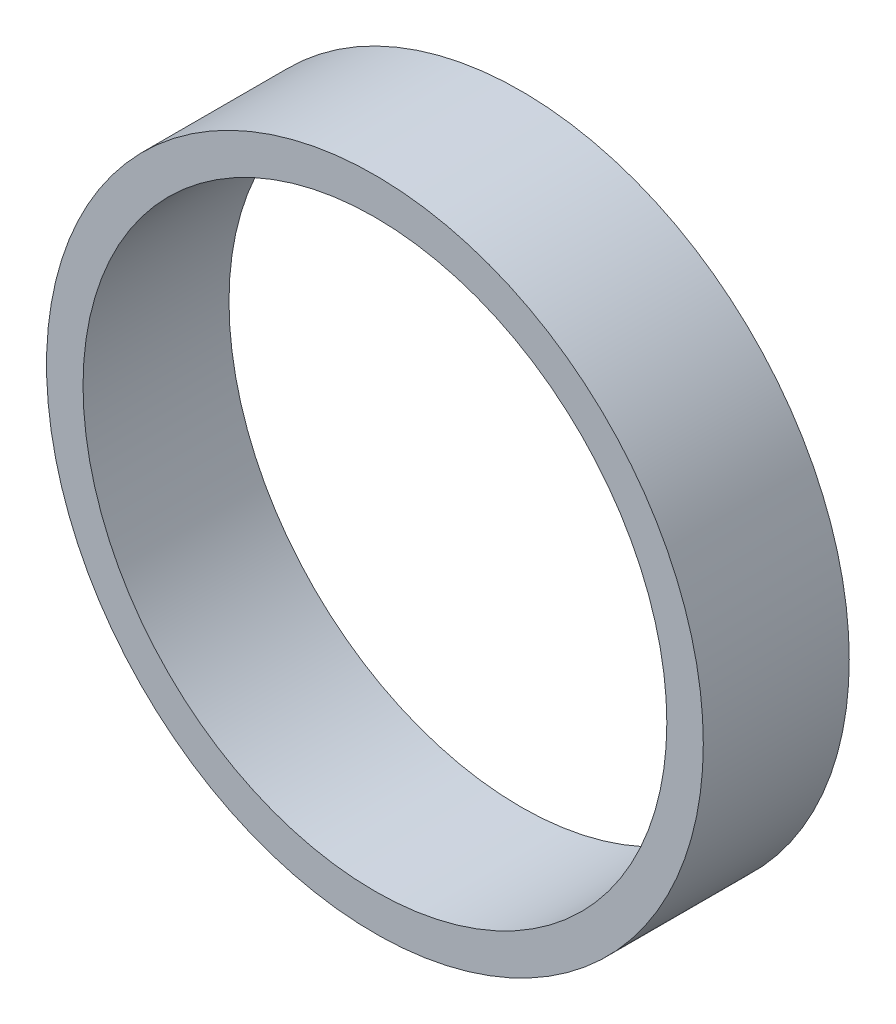
from build123d import *

# Parameters (mm, degrees)
SKETCH1_R           = 57.15
SKETCH1_R_2         = 50.8
BOSS_EXTRUDE1_DEPTH = 25.4


with BuildPart() as part:
    # Sketch1 → Boss-Extrude1 (new body)
    with BuildSketch(Plane.XY):
        Circle(SKETCH1_R)
        Circle(SKETCH1_R_2, mode=Mode.SUBTRACT)
    extrude(amount=BOSS_EXTRUDE1_DEPTH)


solid = part.part
